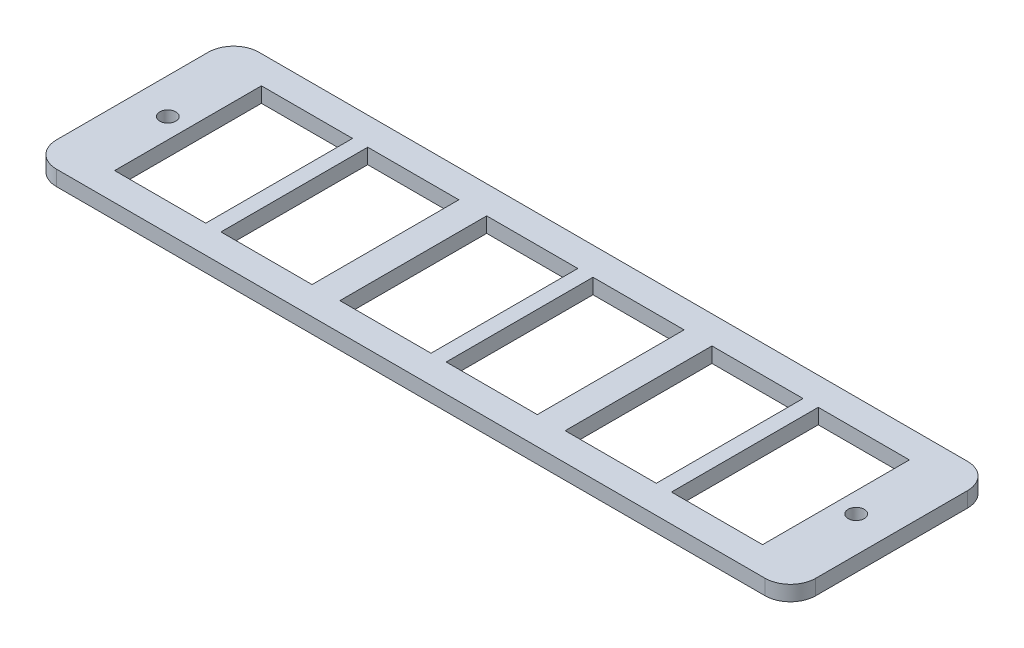
from build123d import *

# Parameters (mm, degrees)
SKETCH_1_W      = 150
SKETCH_1_H      = 40
SKETCH_1_R      = 1.6
SKETCH_1_W_2    = 18
SKETCH_1_H_2    = 29.000000001
EXTRUDE_1_DEPTH = 3
FILLET_1_R      = 5


with BuildPart() as part:
    # ｽｹｯﾁ1 → ﾎﾞｽ - 押し出し1 (new body)
    with BuildSketch(Plane(origin=(0, 0, 0), x_dir=(1, 0, 0), z_dir=(0, 1, 0))):
        with Locations((75, 25)):
            Rectangle(SKETCH_1_W, SKETCH_1_H)
        with Locations(Location((143, 25, 0), (0, 0, 90))):
            Circle(SKETCH_1_R, mode=Mode.SUBTRACT)
        with Locations(Location((7, 25, 0), (0, 0, 270))):
            Circle(SKETCH_1_R, mode=Mode.SUBTRACT)
        with Locations((19.999999998, 24.999999999)):
            Rectangle(SKETCH_1_W_2, SKETCH_1_H_2, mode=Mode.SUBTRACT)
        with Locations((40.999999998, 24.999999999)):
            Rectangle(SKETCH_1_W_2, SKETCH_1_H_2, mode=Mode.SUBTRACT)
        with Locations((64.5, 24.999999999)):
            Rectangle(SKETCH_1_W_2, SKETCH_1_H_2, mode=Mode.SUBTRACT)
        with Locations((85.5, 24.999999999)):
            Rectangle(SKETCH_1_W_2, SKETCH_1_H_2, mode=Mode.SUBTRACT)
        with Locations((109.000000002, 24.999999999)):
            Rectangle(SKETCH_1_W_2, SKETCH_1_H_2, mode=Mode.SUBTRACT)
        with Locations((130.000000002, 24.999999999)):
            Rectangle(SKETCH_1_W_2, SKETCH_1_H_2, mode=Mode.SUBTRACT)
    extrude(amount=EXTRUDE_1_DEPTH)

    # ﾌｨﾚｯﾄ1
    fillet_1_edges = [part.edges().sort_by_distance(p)[0] for p in [
        (0, 1.5, -45),
        (150, 1.5, -45),
        (150, 1.5, -5),
        (0, 1.5, -5),
    ]]
    fillet(fillet_1_edges, radius=FILLET_1_R)


solid = part.part
